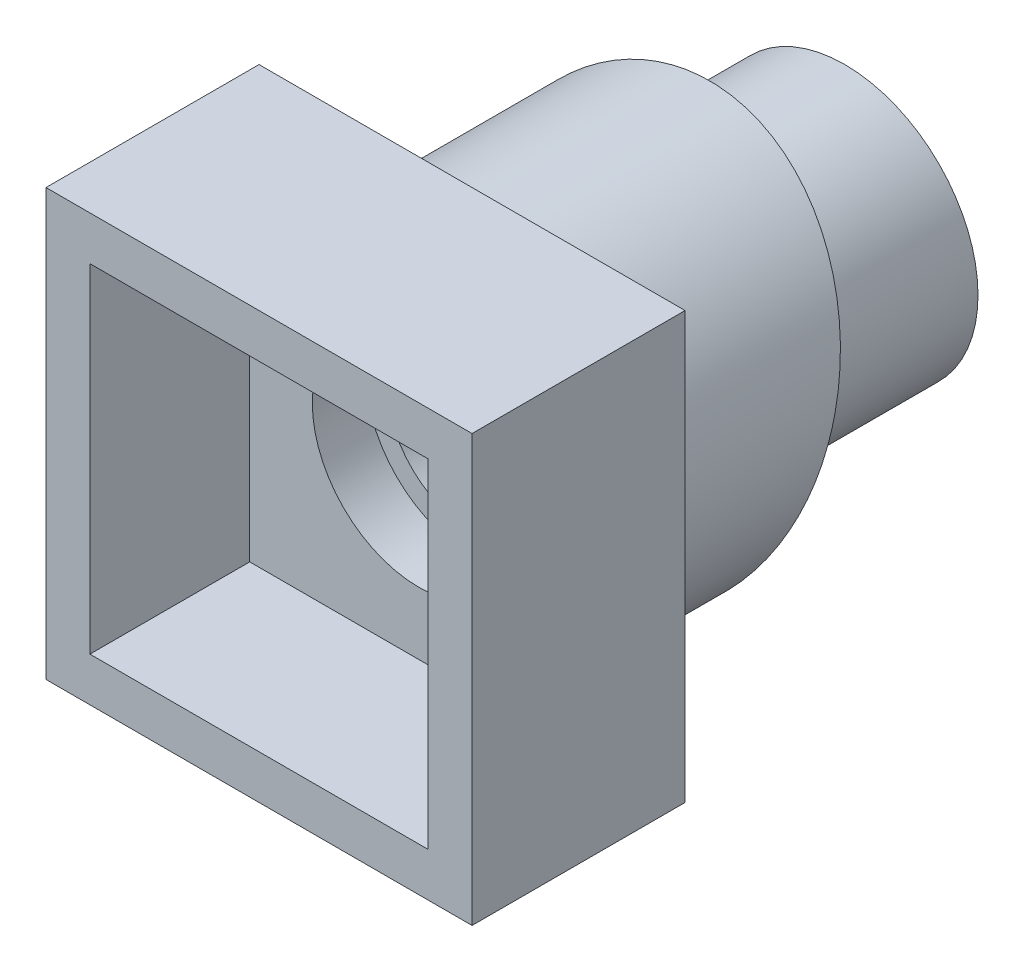
from build123d import *

# Parameters (mm, degrees)
CROQUIS1_R              = 2.5
CROQUIS1_R_2            = 1.8
SALIENTE_EXTRUIR1_DEPTH = 7
SALIENTE_EXTRUIR2_REACH = 14.727
CROQUIS3_R              = 3.5
CROQUIS3_R_2            = 1.6
CROQUIS4_W              = 8
CROQUIS4_H              = 8
CROQUIS4_R              = 2
SALIENTE_EXTRUIR3_DEPTH = 1
CROQUIS6_W              = 8
CROQUIS6_H              = 8
CROQUIS6_W_2            = 6.35
CROQUIS6_H_2            = 6.35
SALIENTE_EXTRUIR5_DEPTH = 3


with BuildPart() as part:
    # Croquis1 → Saliente-Extruir1 (new body)
    with BuildSketch(Plane.XY):
        Circle(CROQUIS1_R)
        Circle(CROQUIS1_R_2, mode=Mode.SUBTRACT)
    extrude(amount=SALIENTE_EXTRUIR1_DEPTH)

    # Saliente-Extruir2: up to this plane
    saliente_extruir2_end = Plane(origin=(0, 1.223696204, 3.362077689), z_dir=(0, -0.34202014332567576, -0.9396926207859059))
    # Croquis3 → Saliente-Extruir2 (add, up to the surface)
    with BuildSketch(Plane.XY.offset(7), mode=Mode.PRIVATE) as saliente_extruir2_sk1:
        Circle(CROQUIS3_R)
        Circle(CROQUIS3_R_2, mode=Mode.SUBTRACT)
    saliente_extruir2_tool1 = split(extrude(saliente_extruir2_sk1.sketch, amount=-SALIENTE_EXTRUIR2_REACH, mode=Mode.PRIVATE), bisect_by=saliente_extruir2_end, keep=Keep.BOTH, mode=Mode.PRIVATE)
    add(saliente_extruir2_tool1.solids().sort_by_distance((-3.401005, 0, 7))[0])

    # Croquis4 → Saliente-Extruir3 (add)
    with BuildSketch(Plane.XY.offset(7)):
        Rectangle(CROQUIS4_W, CROQUIS4_H)
        Circle(CROQUIS4_R, mode=Mode.SUBTRACT)
    extrude(amount=SALIENTE_EXTRUIR3_DEPTH)

    # Croquis6 → Saliente-Extruir5 (add)
    with BuildSketch(Plane.XY.offset(8)):
        Rectangle(CROQUIS6_W, CROQUIS6_H)
        Rectangle(CROQUIS6_W_2, CROQUIS6_H_2, mode=Mode.SUBTRACT)
    extrude(amount=SALIENTE_EXTRUIR5_DEPTH)


solid = part.part
